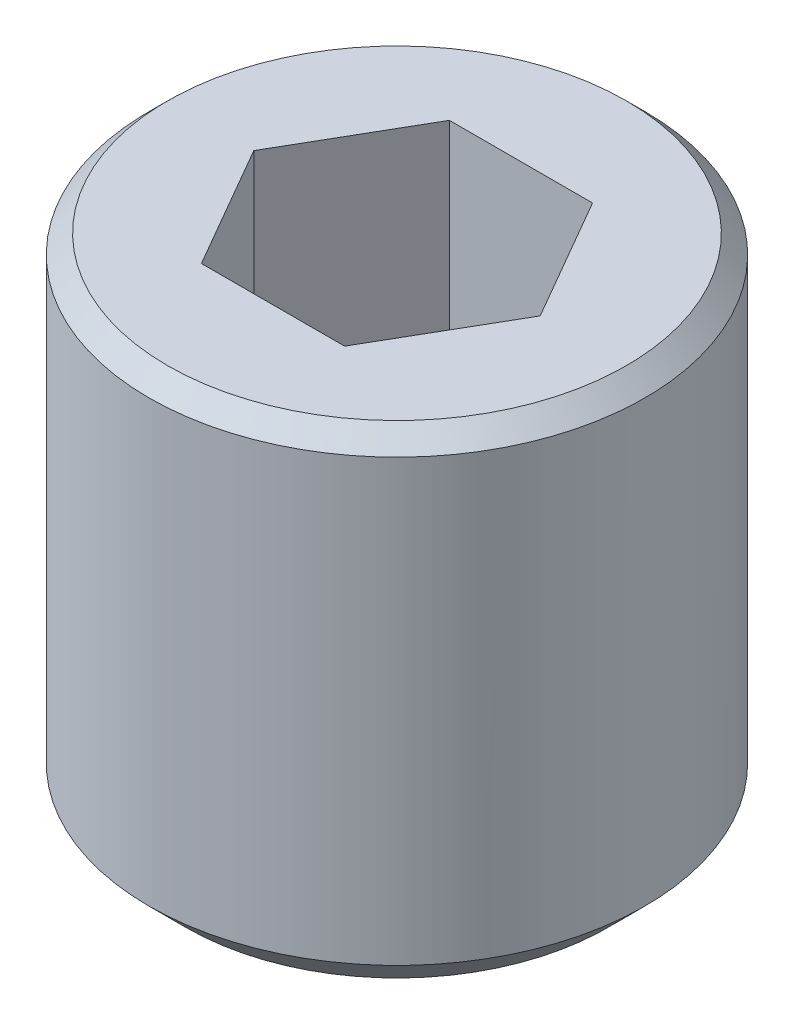
from build123d import *

# Parameters (mm, degrees)
CROQUIS1_W            = 2
CROQUIS1_H            = 4
CORTAR_EXTRUIR2_DEPTH = 2
CHAFL_N3_SIZE         = 0.3
CHAFL_N4_SIZE         = 0.15


with BuildPart() as part:
    # Croquis1 → Revolución1 (revolve)
    with BuildSketch(Plane.XY, mode=Mode.PRIVATE) as revoluci_n1_sk:
        with Locations((1, -2)):
            Rectangle(CROQUIS1_W, CROQUIS1_H)
    revolve(revoluci_n1_sk.sketch.rotate(Axis((0, 0, 0), (0, -1, 0)), 90), axis=Axis((0, 0, 0), (0, -1, 0)))

    # Croquis3 → Cortar-Extruir2 (cut)
    with BuildSketch(Plane(origin=(0, 0, 0), x_dir=(1, 0, 0), z_dir=(0, 1, 0))):
        Polygon((-0.577350269, 1), (-1.154700538, 0), (-0.577350269, -1), (0.577350269, -1), (1.154700538, 0), (0.577350269, 1), align=None)
    extrude(amount=-CORTAR_EXTRUIR2_DEPTH, mode=Mode.SUBTRACT)

    # Chaflán3
    chafl_n3_edges = [part.edges().sort_by_distance(p)[0] for p in [
        (0, -4, -2),
    ]]
    chamfer(chafl_n3_edges, length=CHAFL_N3_SIZE)

    # Chaflán4
    chafl_n4_edges = [part.edges().sort_by_distance(p)[0] for p in [
        (0, 0, -2),
    ]]
    chamfer(chafl_n4_edges, length=CHAFL_N4_SIZE)


solid = part.part
